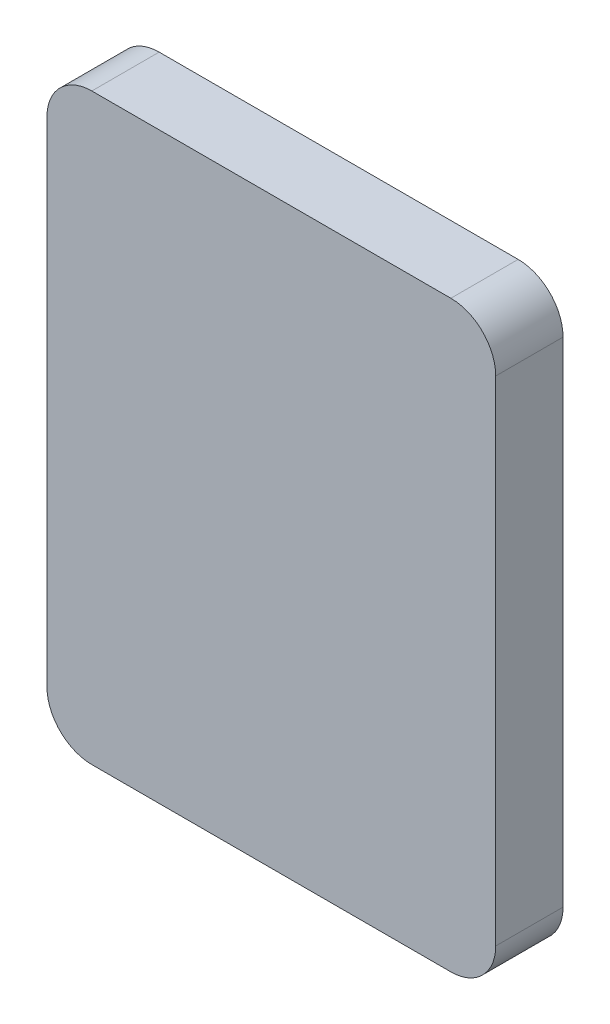
from build123d import *

# Parameters (mm, degrees)
BOSS_EXTRUDE1_DEPTH = 1.5


with BuildPart() as part:
    # Sketch1 → Boss-Extrude1 (new body)
    with BuildSketch(Plane.XY):
        with BuildLine():
            Line((4, -6.5), (-4, -6.5))
            ThreePointArc((-4, -6.5), (-4.707106781, -6.207106781), (-5, -5.5))
            Line((-5, -5.5), (-5, 5.5))
            ThreePointArc((-5, 5.5), (-4.707106781, 6.207106781), (-4, 6.5))
            Line((-4, 6.5), (4, 6.5))
            ThreePointArc((4, 6.5), (4.707106781, 6.207106781), (5, 5.5))
            Line((5, 5.5), (5, -5.5))
            ThreePointArc((5, -5.5), (4.707106781, -6.207106781), (4, -6.5))
        make_face()
    extrude(amount=BOSS_EXTRUDE1_DEPTH)


solid = part.part
